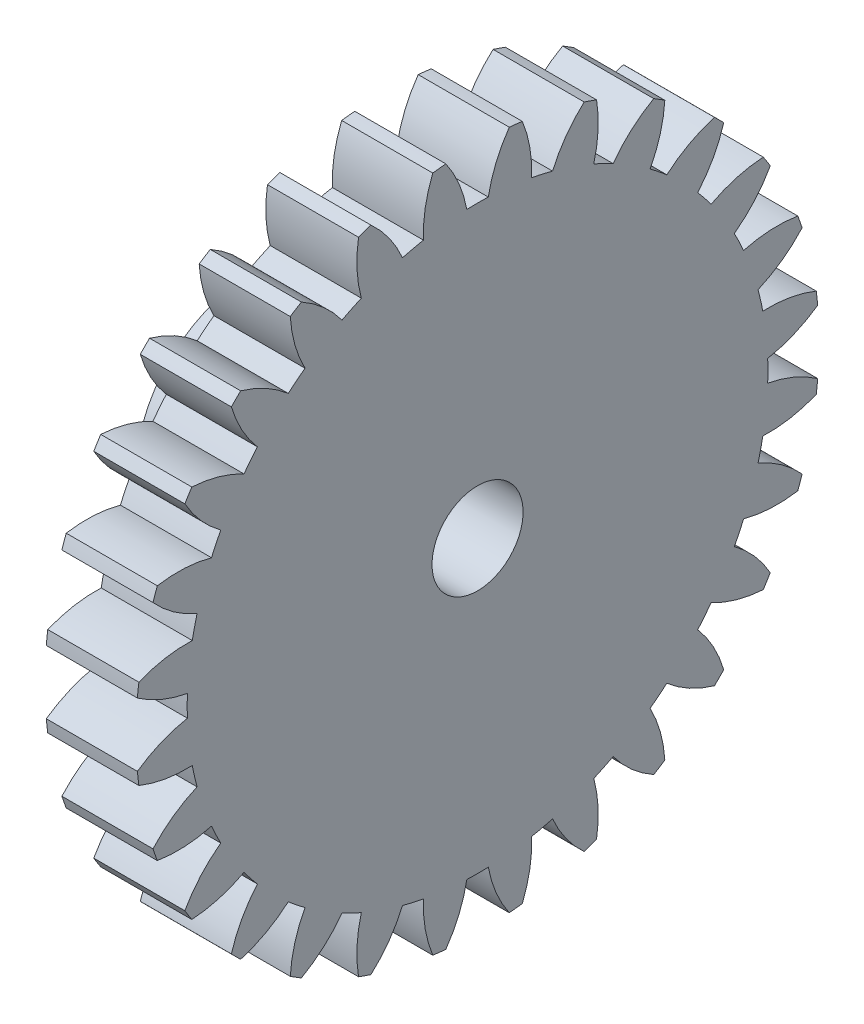
from build123d import *

# Parameters (mm, degrees)
BASPROSKE_W      = 2
BASPROSKE_H      = 7.5
TOOTHCUT_DEPTH   = 11.793516572
TEETHCUTS_COUNT  = 28
TEETHCUTS_ANGLE  = 347.142857143
HUBNEAONESKE_R   = 2.5
HUBNEARONE_DEPTH = 3.0000508
BORSKE_R         = 1
BORE_DEPTH       = 5.0000508


with BuildPart() as part:
    # BasProSke → Base-Revolve (revolve)
    with BuildSketch(Plane(origin=(0, 0, 0), x_dir=(1, 0, 0), z_dir=(0, 1, 0)), mode=Mode.PRIVATE) as base_revolve_sk:
        with Locations((1, 3.75)):
            Rectangle(BASPROSKE_W, BASPROSKE_H)
    revolve(base_revolve_sk.sketch.rotate(Axis((-10, 0, 0), (1, 0, 0)), 180), axis=Axis((-10, 0, 0), (1, 0, 0)))

    # TooCutSke → ToothCut (cut, through all)
    with BuildSketch(Plane(origin=(0, 0, 0), x_dir=(0, 0, -1), z_dir=(1, 0, 0))):
        with BuildLine():
            ThreePointArc((0.235575921, 6.369645201), (0, 6.374), (-0.235575921, 6.369645201))
            ThreePointArc((-0.235575921, 6.369645201), (-0.412688204, 6.956904444), (-0.713425358, 7.491506485))
            ThreePointArc((-0.713425358, 7.491506485), (0, 7.5254), (0.713425358, 7.491506485))
            ThreePointArc((0.713425358, 7.491506485), (0.412688204, 6.956904444), (0.235575921, 6.369645201))
        make_face()
    toothcut = extrude(amount=TOOTHCUT_DEPTH, mode=Mode.SUBTRACT)

    # TeethCuts: ToothCut ×28 about axis
    teethcuts_axis = Axis((-10, 0, 0), (1, 0, 0))
    for i in range(1, TEETHCUTS_COUNT):
        add(toothcut.rotate(teethcuts_axis, i * TEETHCUTS_ANGLE / (TEETHCUTS_COUNT - 1)), mode=Mode.SUBTRACT)

    # HubNeaOneSke → HubNearOne (add)
    with BuildSketch(Plane.ZY):
        with Locations(Location((0, 0, 0), (0, 0, 180))):
            Circle(HUBNEAONESKE_R)
    extrude(amount=HUBNEARONE_DEPTH)

    # BorSke → Bore (cut, symmetric)
    with BuildSketch(Plane(origin=(0, 0, 0), x_dir=(0, 0, -1), z_dir=(1, 0, 0))):
        with Locations(Location((0, 0, 0), (0, 0, 180))):
            Circle(BORSKE_R)
    extrude(amount=BORE_DEPTH, both=True, mode=Mode.SUBTRACT)


solid = part.part
